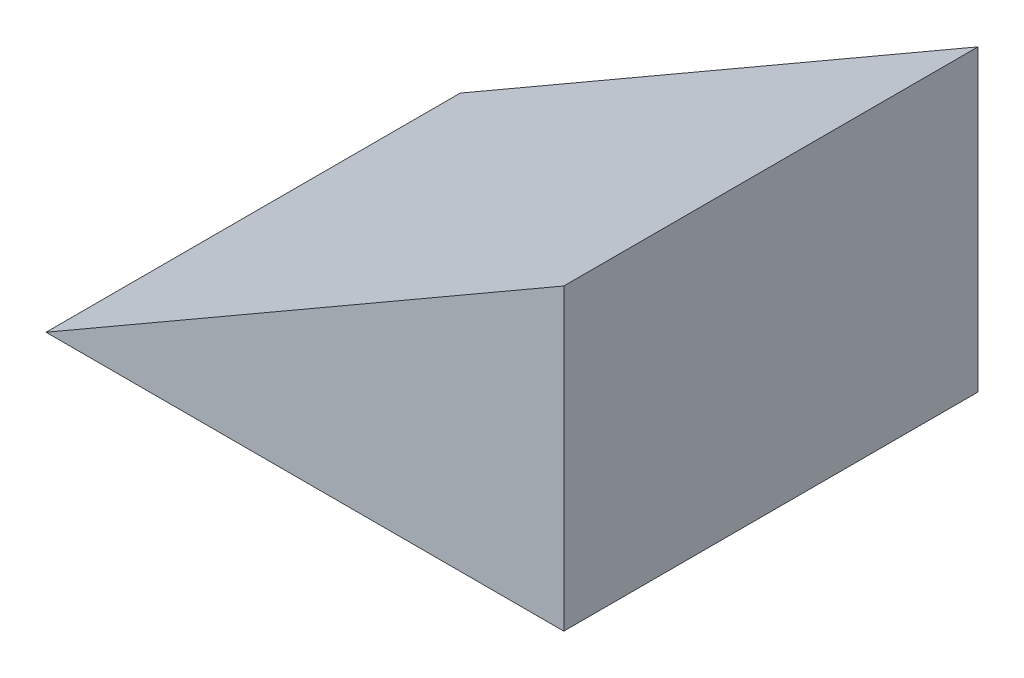
from build123d import *

# Parameters (mm, degrees)
BOSS_EXTRUDE1_DEPTH = 40


with BuildPart() as part:
    # Sketch1 → Boss-Extrude1 (new body)
    with BuildSketch(Plane.XY):
        Polygon((0, 0), (50, 0), (50, 28.867513459), align=None)
    extrude(amount=BOSS_EXTRUDE1_DEPTH)


solid = part.part
